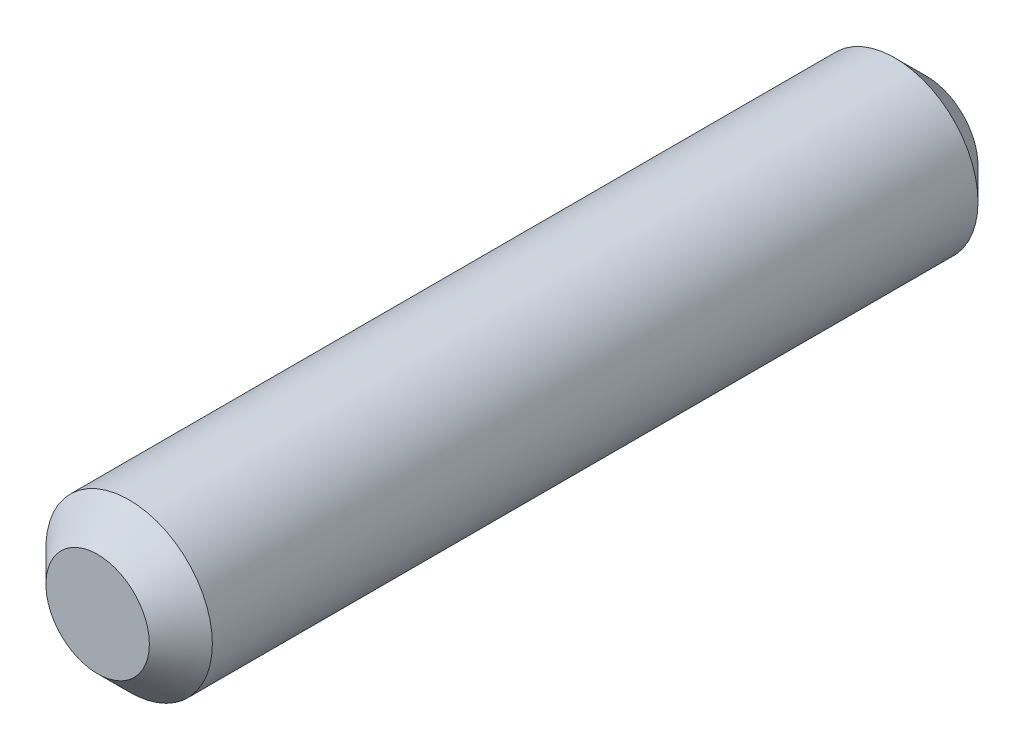
from build123d import *

# Parameters (mm, degrees)
SKETCH1_R           = 1.585
BOSS_EXTRUDE1_DEPTH = 7.89
CHAMFER1_SIZE       = 0.6


with BuildPart() as part:
    # Sketch1 → Boss-Extrude1 (new, symmetric)
    with BuildSketch(Plane.XY):
        Circle(SKETCH1_R)
    extrude(amount=BOSS_EXTRUDE1_DEPTH, both=True)

    # Chamfer1
    chamfer1_edges = [part.edges().sort_by_distance(p)[0] for p in [
        (-1.585, 0, -7.89),
        (-1.585, 0, 7.89),
    ]]
    chamfer(chamfer1_edges, length=CHAMFER1_SIZE)


solid = part.part
